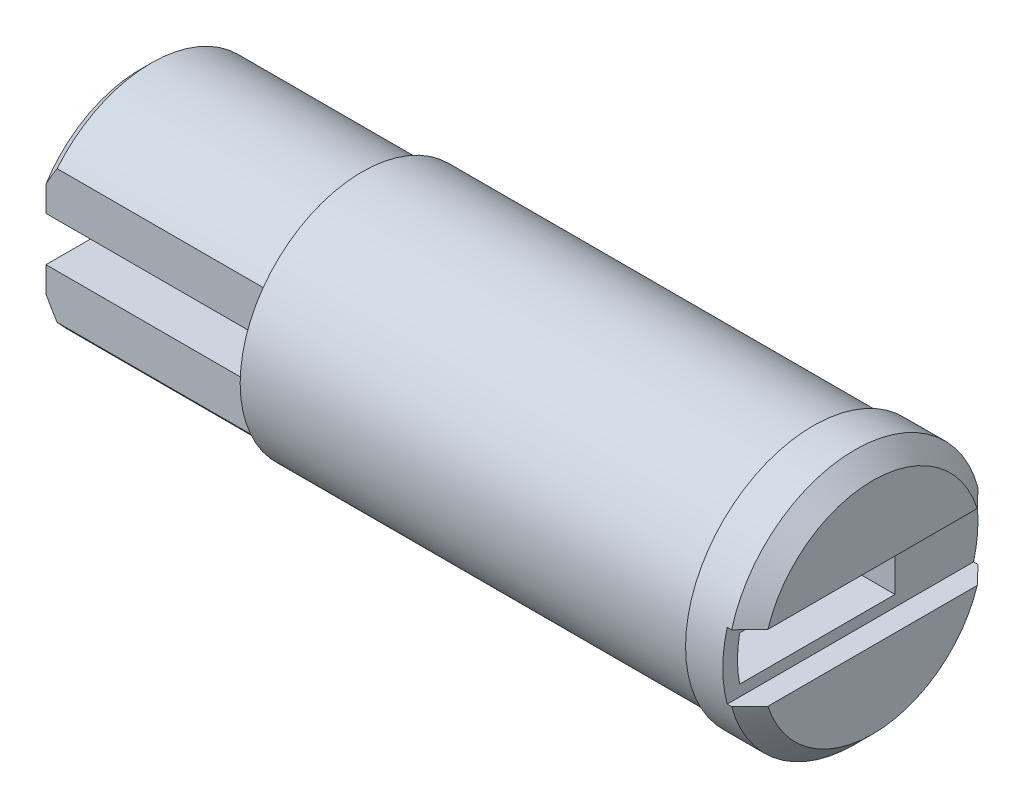
from build123d import *

# Parameters (mm, degrees)
CHAMFER1_SIZE       = 0.8
CHAMFER2_SIZE       = 1
SKETCH3_W           = 14.289580605
SKETCH3_H           = 3
CUT_EXTRUDE1_DEPTH  = 1
SKETCH5_R           = 8.987407092
CUT_EXTRUDE3_DEPTH  = 8
BOSS_EXTRUDE1_DEPTH = 10
CHAMFER3_SIZE       = 0.5
CUT_EXTRUDE4_DEPTH  = 35


with BuildPart() as part:
    # Sketch1 → Revolve1 (revolve)
    with BuildSketch(Plane.XY, mode=Mode.PRIVATE) as revolve1_sk:
        Polygon((31, 0), (31, 5.75), (28.321868185, 5.75), (28.321868185, 5.5), (0, 5.5), (0, 0), align=None)
    revolve(revolve1_sk.sketch.rotate(Axis((0, 0, 0), (1, 0, 0)), 90), axis=Axis((0, 0, 0), (1, 0, 0)))

    # Chamfer1
    chamfer1_edges = [part.edges().sort_by_distance(p)[0] for p in [
        (31, 0, -5.75),
    ]]
    chamfer(chamfer1_edges, length=CHAMFER1_SIZE)

    # Chamfer2
    chamfer2_edges = [part.edges().sort_by_distance(p)[0] for p in [
        (0, 0, -5.5),
    ]]
    chamfer(chamfer2_edges, length=CHAMFER2_SIZE)

    # Sketch3 → Cut-Extrude1 (cut)
    with BuildSketch(Plane(origin=(31, 0, 0), x_dir=(0, 0, -1), z_dir=(1, 0, 0))):
        with Locations((-0.669103075, 0)):
            Rectangle(SKETCH3_W, SKETCH3_H)
    extrude(amount=-CUT_EXTRUDE1_DEPTH, mode=Mode.SUBTRACT)

    # Sketch5 → Cut-Extrude3 (cut)
    with BuildSketch(Plane.ZY):
        Circle(SKETCH5_R)
    extrude(amount=-CUT_EXTRUDE3_DEPTH, mode=Mode.SUBTRACT)

    # Sketch6 → Boss-Extrude1 (add)
    with BuildSketch(Plane.ZY.offset(-8)):
        with BuildLine():
            Line((-4.25, 3), (-4.25, -3))
            ThreePointArc((-4.25, -3), (0, -5), (4.25, -3))
            Line((4.25, -3), (4.25, 3))
            ThreePointArc((4.25, 3), (0, 5), (-4.25, 3))
        make_face()
    extrude(amount=BOSS_EXTRUDE1_DEPTH)

    # Chamfer3
    chamfer3_edges = [part.edges().sort_by_distance(p)[0] for p in [
        (-2, 5, 0),
        (-2, -5, 0),
    ]]
    chamfer(chamfer3_edges, length=CHAMFER3_SIZE)

    # Sketch7 → Cut-Extrude4 (cut)
    with BuildSketch(Plane(origin=(30, 0, 0), x_dir=(0, 0, -1), z_dir=(1, 0, 0))):
        with BuildLine():
            Line((2.009844577, 1), (-4.990155423, 1))
            ThreePointArc((-4.990155423, 1), (-5.089366478, 0), (-4.990155423, -1))
            Line((-4.990155423, -1), (2.009844577, -1))
            Line((2.009844577, -1), (2.009844577, 1))
        make_face()
    extrude(amount=-CUT_EXTRUDE4_DEPTH, mode=Mode.SUBTRACT)


solid = part.part
